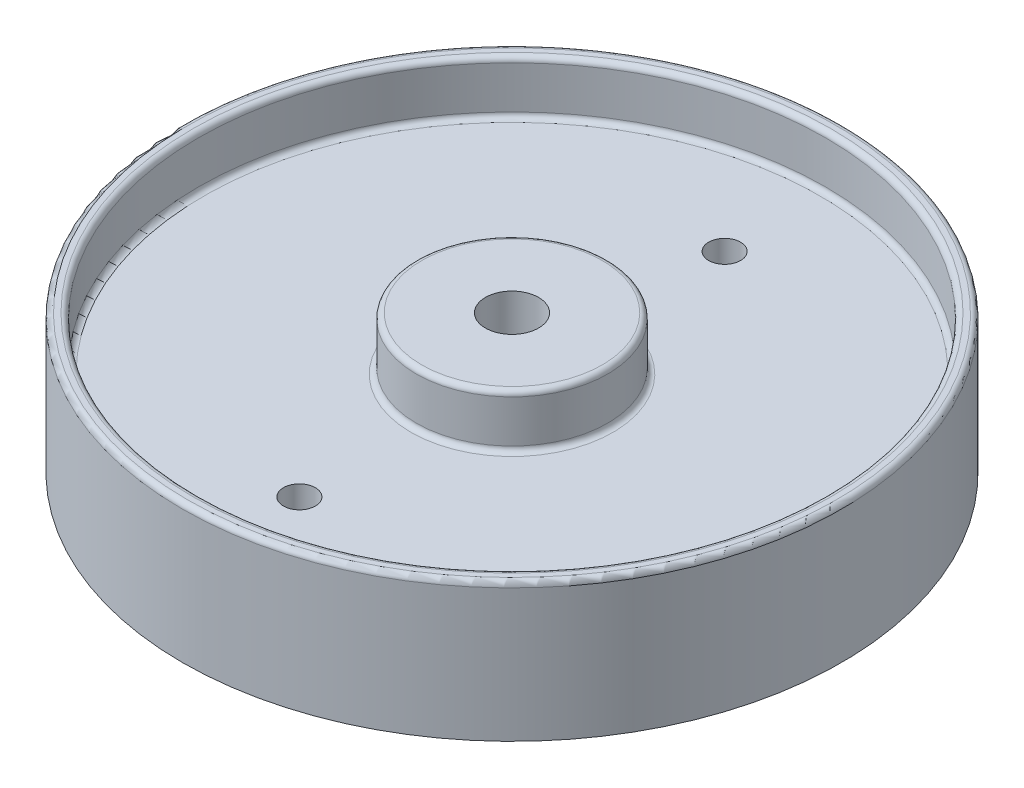
from build123d import *

# Parameters (mm, degrees)
ESQUISSE1_R             = 31
ESQUISSE1_R_2           = 2.5
EXTRUSION1_DEPTH        = 13
ESQUISSE2_R             = 29.5
ESQUISSE2_R_2           = 9
ENL_V_MAT_EXTRU_1_DEPTH = 5
CONG_1_R                = 0.5
ESQUISSE3_R             = 1.5
ENL_V_MAT_EXTRU_2_DEPTH = 5


with BuildPart() as part:
    # Esquisse1 → Extrusion1 (new body)
    with BuildSketch(Plane(origin=(0, 0, 0), x_dir=(1, 0, 0), z_dir=(0, 1, 0))):
        with Locations(Location((0, 0, 0), (0, 0, 90))):
            Circle(ESQUISSE1_R)
        with Locations(Location((0, 0, 0), (0, 0, 90))):
            Circle(ESQUISSE1_R_2, mode=Mode.SUBTRACT)
    extrude(amount=EXTRUSION1_DEPTH)

    # Esquisse2 → Enlèv. mat.-Extru.1 (cut)
    with BuildSketch(Plane(origin=(0, 13, 0), x_dir=(1, 0, 0), z_dir=(0, 1, 0))):
        with Locations(Location((0, 0, 0), (0, 0, 270))):
            Circle(ESQUISSE2_R)
        with Locations(Location((0, 0, 0), (0, 0, 270))):
            Circle(ESQUISSE2_R_2, mode=Mode.SUBTRACT)
    extrude(amount=-ENL_V_MAT_EXTRU_1_DEPTH, mode=Mode.SUBTRACT)

    # Congé1
    cong_1_edges = [part.edges().sort_by_distance(p)[0] for p in [
        (0, 8, -29.5),
        (0, 8, -9),
        (0, 13, -29.5),
        (0, 13, -9),
        (0, 13, 31),
    ]]
    fillet(cong_1_edges, radius=CONG_1_R)

    # Esquisse3 → Enlèv. mat.-Extru.2 (cut)
    with BuildSketch(Plane(origin=(0, 8, 0), x_dir=(1, 0, 0), z_dir=(0, 1, 0))):
        with Locations(Location((0, 20, 0), (0, 0, 270))):
            Circle(ESQUISSE3_R)
        with Locations(Location((0, -20, 0), (0, 0, 270))):
            Circle(ESQUISSE3_R)
    extrude(amount=-ENL_V_MAT_EXTRU_2_DEPTH, mode=Mode.SUBTRACT)


solid = part.part
